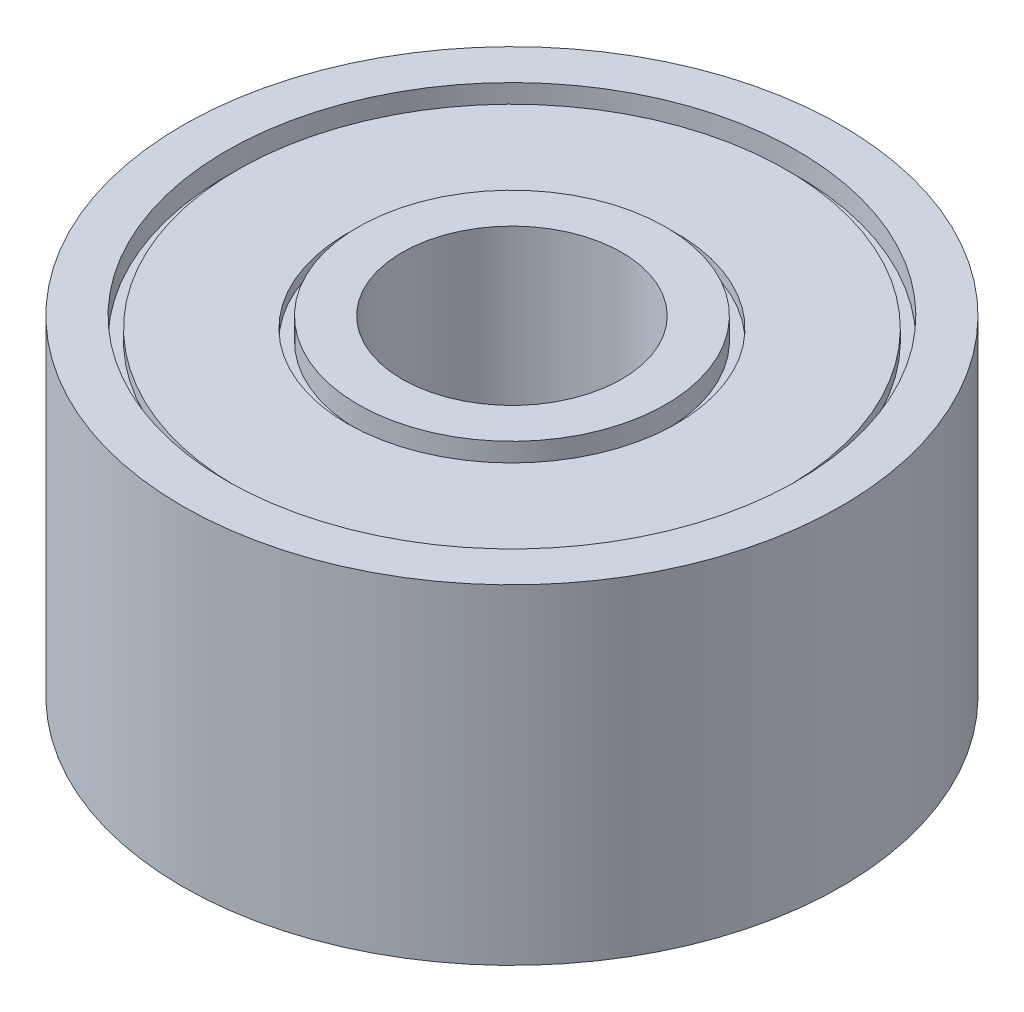
from build123d import *


with BuildPart() as part:
    # Sketch1 → Revolve1 (revolve)
    with BuildSketch(Plane(origin=(0, 0, 0), x_dir=(0, 0, -1), z_dir=(1, 0, 0))):
        Polygon((-3, 0), (-3, -1.5), (-2.6, -1.5), (-2.6, -1.3), (-2.5, -1.3), (-2.5, -1.4), (-1.5, -1.4), (-1.5, -1.3), (-1.4, -1.3), (-1.4, -1.5), (-1, -1.5), (-1, 0), align=None)
    revolve1 = revolve(axis=Axis((0, 0, 0), (0, -1, 0)))

    # Mirror1: Revolve1 across plane
    add(revolve1.mirror(Plane(origin=(0, 0, 1), x_dir=(0, 0, 1), z_dir=(0, 1, 0))))


solid = part.part
